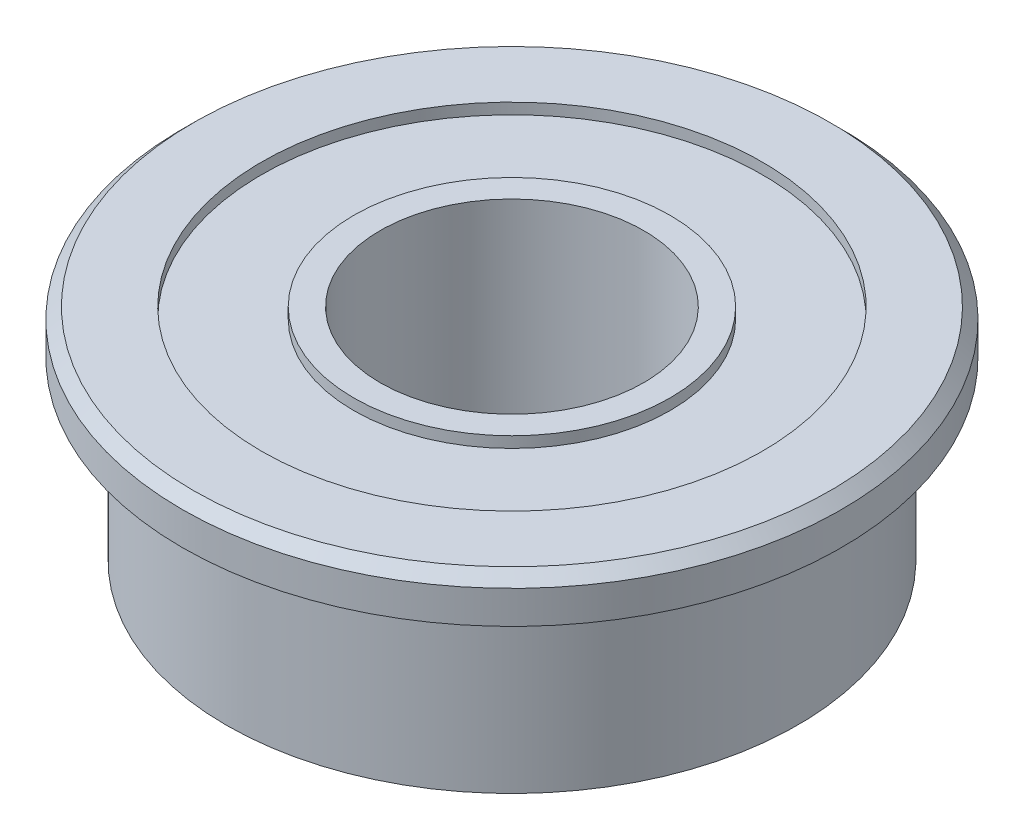
from build123d import *

# Parameters (mm, degrees)
SKETCH1_R           = 6.5
SKETCH1_R_2         = 3
BOSS_EXTRUDE1_DEPTH = 4
SKETCH2_R           = 7.5
SKETCH2_R_2         = 3
BOSS_EXTRUDE2_DEPTH = 1
SKETCH3_R           = 5.7
SKETCH3_R_2         = 3.6
CUT_EXTRUDE1_DEPTH  = 0.25
CUT_EXTRUDE2_START  = -0.25
SKETCH4_R           = 5.7
SKETCH4_R_2         = 3.6
CUT_EXTRUDE2_DEPTH  = 0.25
CHAMFER1_SIZE       = 0.25


with BuildPart() as part:
    # Sketch1 → Boss-Extrude1 (new body)
    with BuildSketch(Plane(origin=(0, 0, 0), x_dir=(1, 0, 0), z_dir=(0, 1, 0))):
        Circle(SKETCH1_R)
        Circle(SKETCH1_R_2, mode=Mode.SUBTRACT)
    extrude(amount=BOSS_EXTRUDE1_DEPTH)

    # Sketch2 → Boss-Extrude2 (add)
    with BuildSketch(Plane(origin=(0, 4, 0), x_dir=(1, 0, 0), z_dir=(0, 1, 0))):
        Circle(SKETCH2_R)
        Circle(SKETCH2_R_2, mode=Mode.SUBTRACT)
    extrude(amount=BOSS_EXTRUDE2_DEPTH)

    # Sketch3 → Cut-Extrude1 (cut)
    with BuildSketch(Plane.XZ):
        Circle(SKETCH3_R)
        Circle(SKETCH3_R_2, mode=Mode.SUBTRACT)
    extrude(amount=-CUT_EXTRUDE1_DEPTH, mode=Mode.SUBTRACT)

    # Sketch4 → Cut-Extrude2 (cut)
    with BuildSketch(Plane(origin=(0, 5, 0), x_dir=(1, 0, 0), z_dir=(0, 1, 0)).offset(CUT_EXTRUDE2_START)):
        Circle(SKETCH4_R)
        Circle(SKETCH4_R_2, mode=Mode.SUBTRACT)
    extrude(amount=CUT_EXTRUDE2_DEPTH, mode=Mode.SUBTRACT)

    # Chamfer1
    chamfer1_edges = [part.edges().sort_by_distance(p)[0] for p in [
        (-7.5, 5, 0),
    ]]
    chamfer(chamfer1_edges, length=CHAMFER1_SIZE)


solid = part.part
